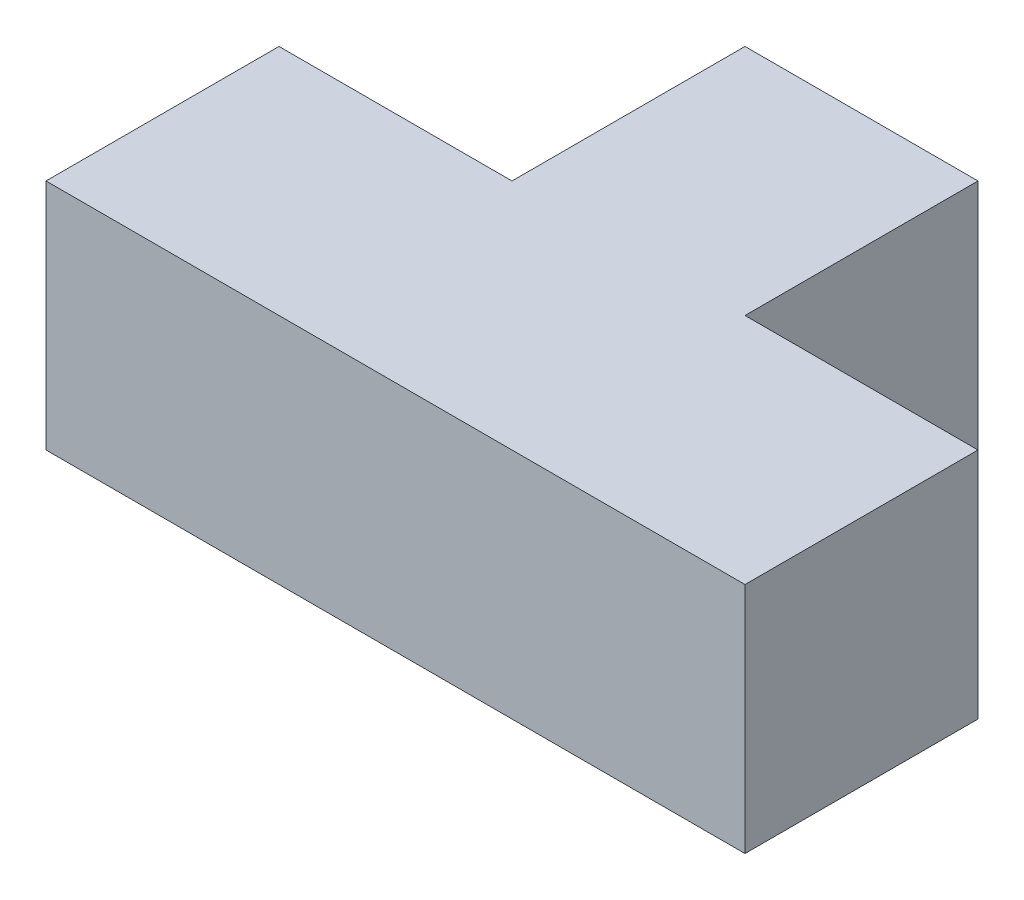
from build123d import *

# Parameters (mm, degrees)
SKETCH_1_W      = 60
SKETCH_1_H      = 30
SKETCH_1_W_2    = 30
EXTRUDE_1_DEPTH = 30
SKETCH_2_W      = 30
SKETCH_2_H      = 30
EXTRUDE_2_DEPTH = 30


with BuildPart() as part:
    # 草圖1 → 填料-伸長1 (new body)
    with BuildSketch(Plane(origin=(0, 0, 0), x_dir=(1, 0, 0), z_dir=(0, 1, 0))):
        with Locations((30, 15)):
            Rectangle(SKETCH_1_W, SKETCH_1_H)
        with Locations((15, 45)):
            Rectangle(SKETCH_1_W_2, SKETCH_1_H)
    extrude(amount=EXTRUDE_1_DEPTH)

    # 草圖2 → 填料-伸長2 (add)
    with BuildSketch(Plane.ZY):
        with Locations((-15, 15)):
            Rectangle(SKETCH_2_W, SKETCH_2_H)
    extrude(amount=EXTRUDE_2_DEPTH)


solid = part.part
